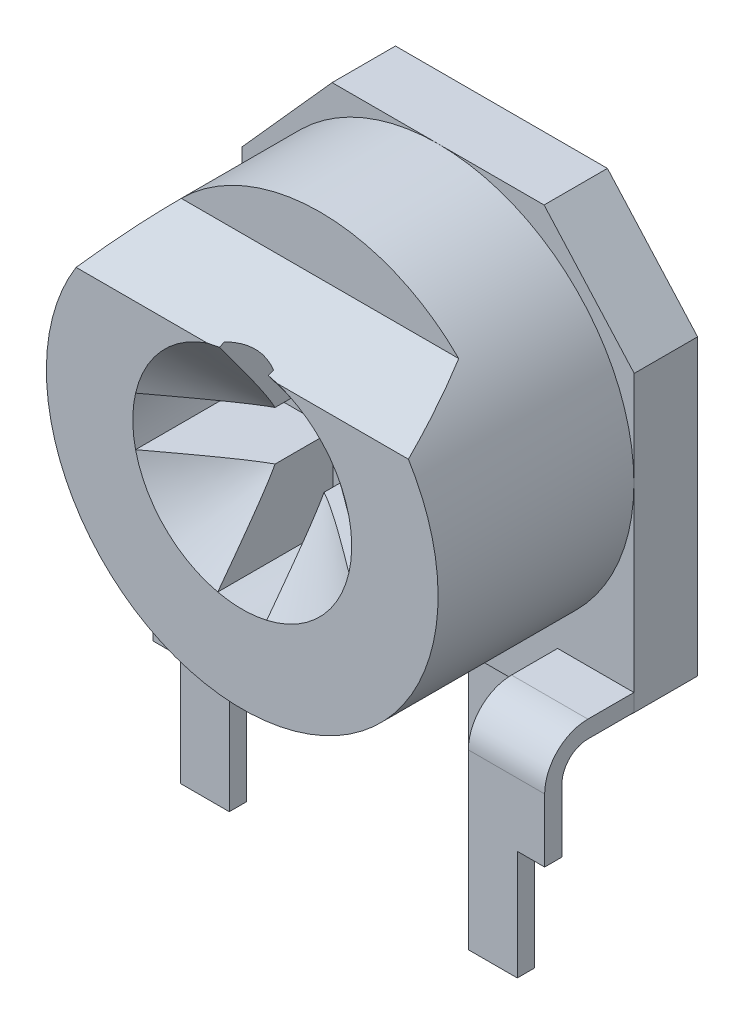
from build123d import *

# Parameters (mm, degrees)
BOSS_EXTRUDE1_DEPTH     = 1.1
SKETCH2_R               = 3.4
BOSS_EXTRUDE2_DEPTH     = 3.4
CUT_EXTRUDE1_DEPTH      = 11.119487388
CUT_EXTRUDE1_DEPTH_BACK = 11.119487388
CUT_EXTRUDE2_DEPTH      = 2
BOSS_EXTRUDE3_DEPTH     = 0.15
BOSS_EXTRUDE4_DEPTH     = 3.4
CUT_EXTRUDE3_START      = -3.4
CUT_EXTRUDE3_DEPTH      = 1.55
SKETCH10_W              = 0.475
SKETCH10_H              = 1.905
CUT_EXTRUDE4_DEPTH      = 10.486518065


with BuildPart() as part:
    # Sketch1 → Boss-Extrude1 (new body)
    with BuildSketch(Plane.XY):
        Polygon((-1.84, 8.4), (-3.405, 6.65), (-3.405, 1.55), (-2.8, 1), (2.8, 1), (3.405, 1.55), (3.405, 6.65), (1.84, 8.4), align=None)
    extrude(amount=BOSS_EXTRUDE1_DEPTH)

    # Sketch2 → Boss-Extrude2 (add)
    with BuildSketch(Plane.XY.offset(1.1)):
        with Locations(Location((0, 5, 0), (0, 0, 180))):
            Circle(SKETCH2_R)
    extrude(amount=BOSS_EXTRUDE2_DEPTH)

    # Sketch3 → Cut-Extrude1 (cut, two sides: drawn at the far end of the back side and taken through both)
    with BuildSketch(Plane(origin=(0, 0, 0), x_dir=(0, 0, -1), z_dir=(1, 0, 0)).offset(-CUT_EXTRUDE1_DEPTH_BACK)):
        Polygon((-3.15, 8.4), (-3.15, 7.4), (-4.5, 6.8), (-4.5, 8.4), align=None)
    extrude(amount=CUT_EXTRUDE1_DEPTH + CUT_EXTRUDE1_DEPTH_BACK, mode=Mode.SUBTRACT)

    # Sketch5 → Cut-Revolve1 (revolve, cut)
    with BuildSketch(Plane(origin=(0, 5, 0), x_dir=(-1, 0, 0), z_dir=(0, 1, 0)), mode=Mode.PRIVATE) as cut_revolve1_sk:
        Polygon((0, 4.5), (-1.9, 4.5), (-0.425, 3.37), (0, 3.37), align=None)
    revolve(cut_revolve1_sk.sketch.rotate(Axis((0, 5, 3.37), (0, 0, 1)), 148.034281249), axis=Axis((0, 5, 3.37), (0, 0, 1)), mode=Mode.SUBTRACT)

    # Sketch6 → Cut-Extrude2 (cut)
    with BuildSketch(Plane.XY.offset(4.5)):
        with BuildLine():
            Line((0.425, 5.425), (1.851857176, 5.425))
            ThreePointArc((1.851857176, 5.425), (1.9, 5), (1.851857176, 4.575))
            Line((1.851857176, 4.575), (0.425, 4.575))
            Line((0.425, 4.575), (0.425, 3.148142824))
            ThreePointArc((0.425, 3.148142824), (0, 3.1), (-0.425, 3.148142824))
            Line((-0.425, 3.148142824), (-0.425, 4.575))
            Line((-0.425, 4.575), (-1.851857176, 4.575))
            ThreePointArc((-1.851857176, 4.575), (-1.9, 5), (-1.851857176, 5.425))
            Line((-1.851857176, 5.425), (-0.425, 5.425))
            Line((-0.425, 5.425), (-0.425, 6.851857176))
            ThreePointArc((-0.425, 6.851857176), (0, 6.9), (0.425, 6.851857176))
            Line((0.425, 6.851857176), (0.425, 5.425))
        make_face()
    extrude(amount=-CUT_EXTRUDE2_DEPTH, mode=Mode.SUBTRACT)

    # Sketch7 → Boss-Extrude3 (add, symmetric)
    with BuildSketch(Plane.XY):
        with BuildLine():
            Line((-0.425, 0.21), (-0.425, -1.905))
            Line((-0.425, -1.905), (0.425, -1.905))
            Line((0.425, -1.905), (0.425, 0.21))
            Line((0.425, 0.21), (0.875, 0.21))
            Line((0.875, 0.21), (0.875, 1))
            ThreePointArc((0.875, 1), (0, 1.875), (-0.875, 1))
            Line((-0.875, 1), (-0.875, 0.21))
            Line((-0.875, 0.21), (-0.425, 0.21))
        make_face()
    extrude(amount=BOSS_EXTRUDE3_DEPTH, both=True)

    # Sketch8 → Boss-Extrude4 (add, symmetric)
    with BuildSketch(Plane(origin=(0, 0, 0), x_dir=(0, 0, -1), z_dir=(1, 0, 0))):
        with BuildLine():
            Line((0, 1.85), (-1.9, 1.85))
            ThreePointArc((-1.9, 1.85), (-2.430330086, 1.630330086), (-2.65, 1.1))
            Line((-2.65, 1.1), (-2.65, -1.905))
            Line((-2.65, -1.905), (-2.35, -1.905))
            Line((-2.35, -1.905), (-2.35, 1.1))
            ThreePointArc((-2.35, 1.1), (-2.218198052, 1.418198052), (-1.9, 1.55))
            Line((-1.9, 1.55), (0, 1.55))
            Line((0, 1.55), (0, 1.85))
        make_face()
    extrude(amount=BOSS_EXTRUDE4_DEPTH, both=True)

    # Sketch9 → Cut-Extrude3 (cut)
    with BuildSketch(Plane.XY.offset(4.5).offset(CUT_EXTRUDE3_START)):
        with BuildLine():
            Line((-2.075, -1.905), (-2.075, 2.306605302))
            ThreePointArc((-2.075, 2.306605302), (0, 1.6), (2.075, 2.306605302))
            Line((2.075, 2.306605302), (2.075, -1.905))
            Line((2.075, -1.905), (-2.075, -1.905))
        make_face()
    extrude(amount=CUT_EXTRUDE3_DEPTH, mode=Mode.SUBTRACT)

    # Sketch10 → Cut-Extrude4 (cut, through all)
    with BuildSketch(Plane.XY.offset(2.65)):
        with Locations((-3.1625, -0.9525)):
            Rectangle(SKETCH10_W, SKETCH10_H)
        with Locations((3.1625, -0.9525)):
            Rectangle(SKETCH10_W, SKETCH10_H)
    extrude(amount=-CUT_EXTRUDE4_DEPTH, mode=Mode.SUBTRACT)


solid = part.part
